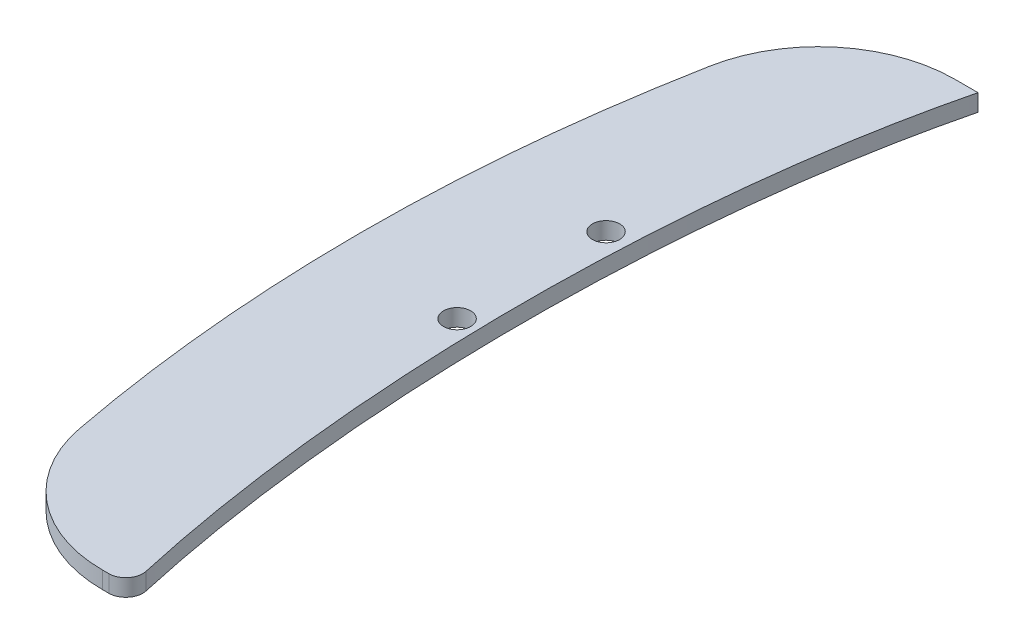
from build123d import *

# Parameters (mm, degrees)
ESBO_O1_R                = 2
RESSALTO_EXTRUS_O1_DEPTH = 2.5


with BuildPart() as part:
    # Esboço1 → Ressalto-extrusão1 (new body)
    with BuildSketch(Plane(origin=(0, 0, 0), x_dir=(1, 0, 0), z_dir=(0, 1, 0))):
        with BuildLine():
            Line((11.040621421, -63.022227155), (11.975083319, -63.022227155))
            ThreePointArc((11.975083319, -63.022227155), (13.927517872, -62.083636556), (14.413923052, -59.972626609))
            add(Edge.make_bspline(
                [(14.628150734, 61.977772845), (9.961904295, 43.145041124), (5.80089976, 0.158887719), (10.360032358, -41.983580286), (14.413923052, -59.972626609)],
                knots=[0, 0, 0, 0, 0.486126784, 0.972253568, 0.972253568, 0.972253568, 0.972253568], degree=3))
            Line((14.628150734, 61.977772845), (11.221984798, 61.977772845))
            ThreePointArc((11.221984798, 61.977772845), (-1.551940129, 57.366952224), (-8.43603741, 45.660457041))
            add(Edge.make_bspline(
                [(-8.43603741, 45.660457041), (-10.928367674, 32.356496924), (-14.334494692, 2.382887461), (-11.960473063, -29.417729259), (-8.595648838, -46.819185188)],
                knots=[0.126810365, 0.126810365, 0.126810365, 0.126810365, 0.438278248, 0.866480416, 0.866480416, 0.866480416, 0.866480416], degree=3))
            ThreePointArc((-8.595648838, -46.819185188), (-1.688495582, -58.448489837), (11.040621421, -63.022227155))
        make_face()
        with Locations(Location((5.00152215, 16.977772845, 0), (0, 0, 270))):
            Circle(ESBO_O1_R, mode=Mode.SUBTRACT)
        with Locations(Location((5.125334517, -5.021878755, 0), (0, 0, 270))):
            Circle(ESBO_O1_R, mode=Mode.SUBTRACT)
    extrude(amount=RESSALTO_EXTRUS_O1_DEPTH)


solid = part.part
